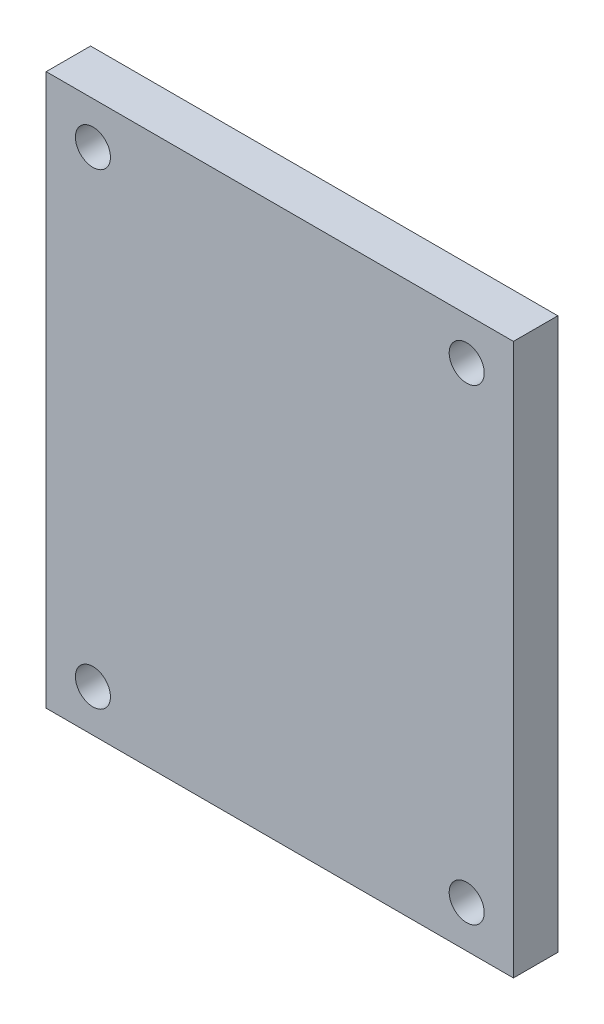
from build123d import *

# Parameters (mm, degrees)
SKETCH1_W           = 50.8
SKETCH1_H           = 59.944
SKETCH1_R           = 1.905
BOSS_EXTRUDE1_DEPTH = 4.826


with BuildPart() as part:
    # Sketch1 → Boss-Extrude1 (new body)
    with BuildSketch(Plane.XY):
        with Locations((25.4, 29.972)):
            Rectangle(SKETCH1_W, SKETCH1_H)
        with Locations((5.08, 55.372)):
            Circle(SKETCH1_R, mode=Mode.SUBTRACT)
        with Locations((5.08, 4.572)):
            Circle(SKETCH1_R, mode=Mode.SUBTRACT)
        with Locations((45.72, 55.372)):
            Circle(SKETCH1_R, mode=Mode.SUBTRACT)
        with Locations((45.72, 4.572)):
            Circle(SKETCH1_R, mode=Mode.SUBTRACT)
    extrude(amount=BOSS_EXTRUDE1_DEPTH)


solid = part.part
